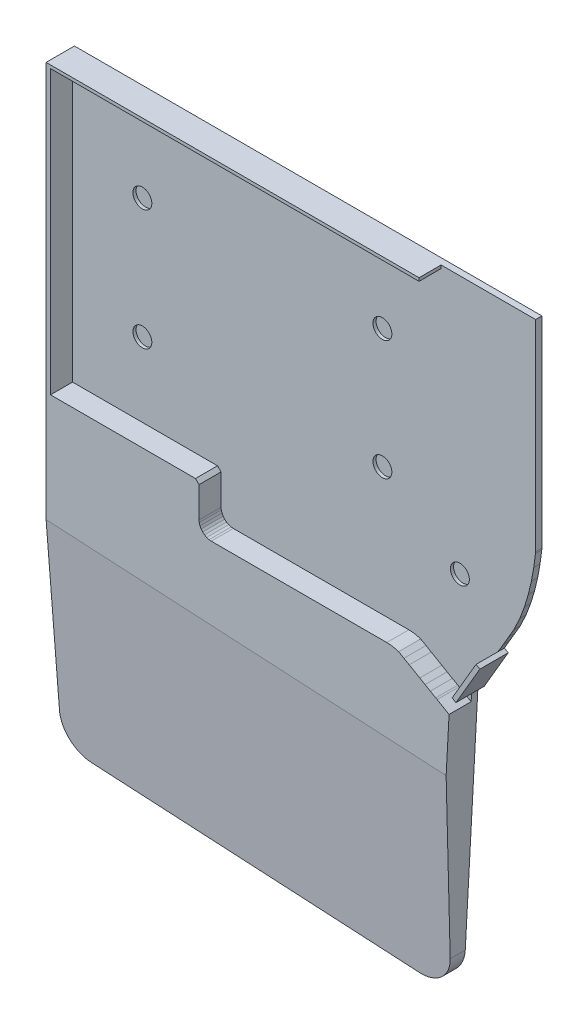
from build123d import *

# Parameters (mm, degrees)
SKETCH_1_W          = 147
SKETCH_1_H          = 194
EXTRUDE_1_DEPTH     = 2
CUT_EXTRUDE_1_DEPTH = 122.717911582
EXTRUDE_2_DEPTH     = 7
EXTRUDE_12_DEPTH    = 2
EXTRUDE_13_DEPTH    = 7
SKETCH_9_W          = 30
SKETCH_9_H          = 7
CUT_EXTRUDE_2_DEPTH = 8
CUT_EXTRUDE_3_DEPTH = 165.668883446
CUT_EXTRUDE_4_DEPTH = 125.640523105
FILLET_1_R          = 10
SKETCH_15_R         = 3
CUT_EXTRUDE_5_DEPTH = 1


with BuildPart() as part:
    # 草图1 → 凸台-拉伸1 (new body)
    with BuildSketch(Plane.XY):
        Rectangle(SKETCH_1_W, SKETCH_1_H)
    extrude(amount=EXTRUDE_1_DEPTH)

    # 草图3 → 切除-拉伸1 (cut, through all)
    with BuildSketch(Plane.XY.offset(2)):
        Polygon((53.23522436, -12.067612089), (54.895536272, -9.227626556), (56.571241133, -6.361232674), (59.922644339, -0.628613065), (61.598241137, 2.237687122), (63.273937257, 5.103974498), (64.949644621, 7.97037266), (66.685320016, 10.939281948), (68.474937854, 14.800520519), (69.965464928, 18.751847603), (71.186607188, 22.785544771), (72.160677785, 26.878843337), (72.909711272, 31.009687619), (73.455390422, 35.156598129), (73.81891313, 39.298369912), (74.02249192, 43.433108573), (74.02249192, 45), (75.723074591, 45), (75.723074591, -104.819726649), (48.204220565, -104.819726649), align=None)
    extrude(amount=-CUT_EXTRUDE_1_DEPTH, mode=Mode.SUBTRACT)

    # 草图4 → 凸台-拉伸2 (add)
    with BuildSketch(Plane.XY.offset(2)):
        with BuildLine():
            Line((-26.359304292, 7.671510526), (-26.359304292, -2.050234399))
            Line((-26.359304292, -2.050234399), (-26.291229671, -2.727324911))
            Line((-26.291229671, -2.727324911), (-26.056539241, -3.484651495))
            Line((-26.056539241, -3.484651495), (-25.685607127, -4.168114429))
            Line((-25.685607127, -4.168114429), (-25.196433295, -4.761489945))
            Line((-25.196433295, -4.761489945), (-24.602579713, -5.251299759))
            Line((-24.602579713, -5.251299759), (-23.918848604, -5.622103659))
            Line((-23.918848604, -5.622103659), (-23.16220103, -5.856620758))
            Line((-23.16220103, -5.856620758), (-22.484966559, -5.924875416))
            Line((-22.484966559, -5.924875416), (33.258451472, -5.924875416))
            ThreePointArc((33.258451472, -5.924875416), (35.166456954, -6.084261893), (37.021573693, -6.558003228))
            Line((37.021573693, -6.558003228), (38.696489946, -7.527643824))
            Line((38.696489946, -7.527643824), (40.372194808, -8.497858613))
            Line((40.372194808, -8.497858613), (43.723589271, -10.43804405))
            Line((43.723589271, -10.43804405), (45.399266369, -11.408242764))
            Line((45.399266369, -11.408242764), (47.074877038, -12.378342789))
            Line((47.074877038, -12.378342789), (48.808729273, -13.382197265))
            Line((48.808729273, -13.382197265), (49.23970493, -13.601689934))
            Line((49.23970493, -13.601689934), (53.032447862, -15.806020922))
            Line((53.032447862, -15.806020922), (48.628373423, -97))
            Line((48.628373423, -97), (-73.5, -97))
            Line((-73.5, -97), (-73.5, 8.797108615))
            Line((-73.5, 8.797108615), (-69.625285972, 8.797108615))
            Line((-69.625285972, 8.797108615), (-27.484917142, 8.797108615))
            Line((-27.484917142, 8.797108615), (-26.359304292, 7.671510526))
        make_face()
    extrude(amount=EXTRUDE_2_DEPTH)

    # 草图6 → 凸台-拉伸12 (add)
    with BuildSketch(Plane(origin=(0, 0, 0), x_dir=(-1, 0, 0), z_dir=(0, 0, -1))):
        Polygon((-61.598241137, 2.237687122), (-53.998328187, -10.762312878), (-55.206947225, -11.468882068), (-62.806860175, 1.531117932), align=None)
        Polygon((-73.5, 97), (73.5, 97), (73.5, -97), (74.9, -97), (74.9, 87), (74.9, 99.5), (-73.5, 99.5), align=None)
    extrude(amount=-EXTRUDE_12_DEPTH)

    # 草图7 → 凸台-拉伸13 (add)
    with BuildSketch(Plane.XY.offset(2)):
        Polygon((-74.9, 99.5), (-74.9, -97), (-73.5, -97), (-73.5, 98.5), (73.5, 98.5), (73.5, 99.5), align=None)
        Polygon((61.598241137, 2.237687122), (53.998328187, -10.762312878), (55.206947225, -11.468882068), (62.806860175, 1.531117932), align=None)
    extrude(amount=EXTRUDE_13_DEPTH)

    # 草图9 → 切除-拉伸2 (cut)
    with BuildSketch(Plane(origin=(0, 99.5, 0), x_dir=(1, 0, 0), z_dir=(0, 1, 0))):
        with Locations((58.5, -5.5)):
            Rectangle(SKETCH_9_W, SKETCH_9_H)
    extrude(amount=-CUT_EXTRUDE_2_DEPTH, mode=Mode.SUBTRACT)

    # 草图10 → 切除-拉伸3 (cut, through all)
    with BuildSketch(Plane(origin=(53.731702858, -2.914482352, 0), x_dir=(0, 0, -1), z_dir=(0.9985321738095838, -0.054161774962672445, 0))):
        Polygon((-9, -30.223821841), (-4, -94.223821841), (-4, -111.514790755), (-9, -111.514790755), (-9, -94.223821841), align=None)
    extrude(amount=-CUT_EXTRUDE_3_DEPTH, mode=Mode.SUBTRACT)

    # 草图11 → 切除-拉伸4 (cut, through all)
    with BuildSketch(Plane.XY.offset(4)):
        Polygon((-74.9, -90.299649087), (-74.9, -97), (48.628373423, -97), align=None)
    extrude(amount=-CUT_EXTRUDE_4_DEPTH, mode=Mode.SUBTRACT)

    # 圆角1
    fillet_1_edges = [part.edges().sort_by_distance(p)[0] for p in [
        (-74.9, -90.299649087, 2),
        (48.628373423, -97, 2),
    ]]
    fillet(fillet_1_edges, radius=FILLET_1_R)

    # 草图15 → 切除-拉伸5 (cut)
    with BuildSketch(Plane.XY.offset(2)):
        with Locations((-51.34000037, 70.5)):
            Circle(SKETCH_15_R)
        with Locations((-51.34000037, 32.300001397)):
            Circle(SKETCH_15_R)
        with Locations((24.859996084, 72.7)):
            Circle(SKETCH_15_R)
        with Locations((24.859996084, 34.700002149)):
            Circle(SKETCH_15_R)
        with Locations((49.459993167, 17.5)):
            Circle(SKETCH_15_R)
    extrude(amount=-CUT_EXTRUDE_5_DEPTH, mode=Mode.SUBTRACT)


solid = part.part
